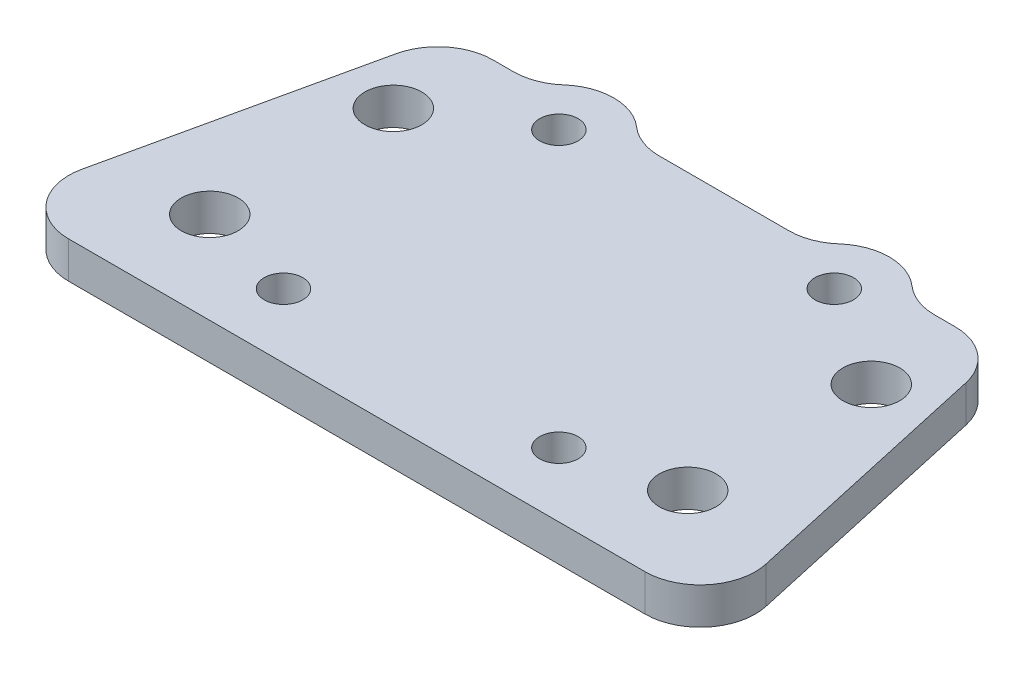
from build123d import *

# Parameters (mm, degrees)
EXTRUDE_1_DEPTH     = 2
SKETCH_2_R          = 1.55
CUT_EXTRUDE_1_DEPTH = 22.950475716
SKETCH_3_R          = 1.05
CUT_EXTRUDE_2_DEPTH = 22.950475716
FILLET_2_R          = 3
EXTRUDE_2_DEPTH     = 2
FILLET_4_R          = 3


with BuildPart() as part:
    # 草图1 → 凸台-拉伸1 (new body)
    with BuildSketch(Plane(origin=(0, 0, 0), x_dir=(1, 0, 0), z_dir=(0, 1, 0))):
        Polygon((-19.437679495, -10), (19.437679495, -10), (15, 10), (-15, 10), align=None)
    extrude(amount=EXTRUDE_1_DEPTH)

    # 草图2 → 切除-拉伸1 (cut, through all)
    with BuildSketch(Plane(origin=(0, 2, 0), x_dir=(1, 0, 0), z_dir=(0, 1, 0))):
        with Locations(Location((-13.01801017, 5, 0), (0, 0, 270))):
            Circle(SKETCH_2_R)
        with Locations(Location((-13.01801017, -5, 0), (0, 0, 270))):
            Circle(SKETCH_2_R)
        with Locations(Location((13.01801017, -5, 0), (0, 0, 90))):
            Circle(SKETCH_2_R)
        with Locations(Location((13.01801017, 5, 0), (0, 0, 90))):
            Circle(SKETCH_2_R)
    extrude(amount=-CUT_EXTRUDE_1_DEPTH, mode=Mode.SUBTRACT)

    # 草图3 → 切除-拉伸2 (cut, through all)
    with BuildSketch(Plane(origin=(0, 2, 0), x_dir=(1, 0, 0), z_dir=(0, 1, 0))):
        with Locations(Location((-7.5, 8.5, 0), (0, 0, 270))):
            Circle(SKETCH_3_R)
        with Locations(Location((-7.5, -6.5, 0), (0, 0, 270))):
            Circle(SKETCH_3_R)
        with Locations(Location((7.5, -6.5, 0), (0, 0, 270))):
            Circle(SKETCH_3_R)
        with Locations(Location((7.5, 8.5, 0), (0, 0, 270))):
            Circle(SKETCH_3_R)
    extrude(amount=-CUT_EXTRUDE_2_DEPTH, mode=Mode.SUBTRACT)

    # 圆角2
    fillet_2_edges = [part.edges().sort_by_distance(p)[0] for p in [
        (-15, 1, -10),
        (15, 1, -10),
        (19.437679495, 1, 10),
        (-19.437679495, 1, 10),
    ]]
    fillet(fillet_2_edges, radius=FILLET_2_R)

    # 草图4 → 凸台-拉伸2 (add)
    with BuildSketch(Plane(origin=(0, 2, 0), x_dir=(1, 0, 0), z_dir=(0, 1, 0))):
        with BuildLine():
            ThreePointArc((-4.901923789, 10), (-7.5, 11.5), (-10.098076211, 10))
            Line((-10.098076211, 10), (-4.901923789, 10))
        make_face()
        with BuildLine():
            ThreePointArc((10.098076211, 10), (7.5, 11.5), (4.901923789, 10))
            Line((4.901923789, 10), (10.098076211, 10))
        make_face()
    extrude(amount=-EXTRUDE_2_DEPTH)

    # 圆角4
    fillet_4_edges = [part.edges().sort_by_distance(p)[0] for p in [
        (10.098076211, 1, -10),
        (4.901923789, 1, -10),
        (-4.901923789, 1, -10),
        (-10.098076211, 1, -10),
    ]]
    fillet(fillet_4_edges, radius=FILLET_4_R)


solid = part.part
